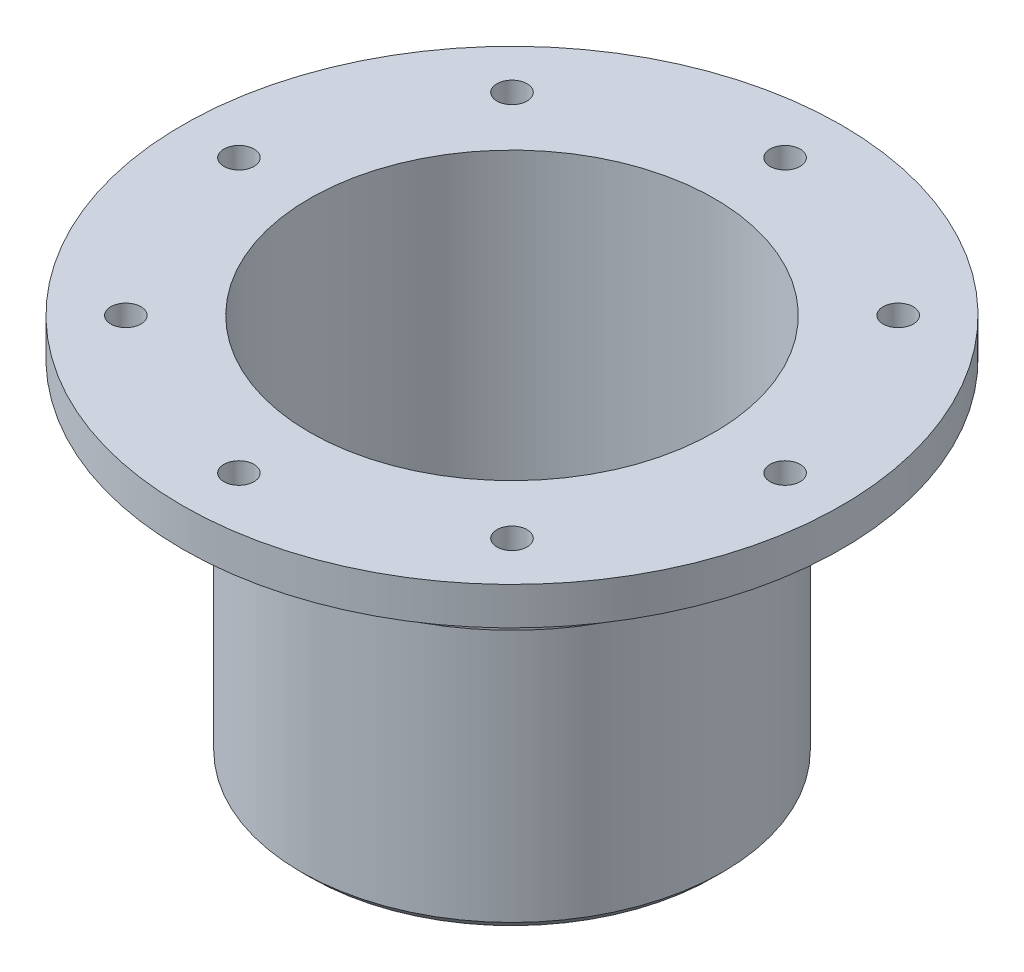
from build123d import *

# Parameters (mm, degrees)
SKETCH_1_R      = 22.4
SKETCH_1_R_2    = 2
SKETCH_1_R_3    = 14
EXTRUDE_1_DEPTH = 3
EXTRUDE_START   = 34
SKETCH_1_3_R    = 22.4
SKETCH_1_3_R_2  = 21.5
EXTRUDE_2_DEPTH = 34
EXTRUDE_START_2 = 4
SKETCH_2_R      = 35
SKETCH_2_R_2    = 21.5
SKETCH_2_R_3    = 1.6
EXTRUDE_3_DEPTH = 4
SKETCH_3_R      = 24
SKETCH_3_R_2    = 22.4
EXTRUDE_4_DEPTH = 8
CHAMFER_1_SIZE  = 1


with BuildPart() as part:
    # 草图1 → 凸台-拉伸1 (new body)
    with BuildSketch(Plane(origin=(0, 0, 0), x_dir=(1, 0, 0), z_dir=(0, 1, 0))):
        Circle(SKETCH_1_R)
        with Locations((0, -17.5)):
            Circle(SKETCH_1_R_2, mode=Mode.SUBTRACT)
        with Locations((-17.5, 0)):
            Circle(SKETCH_1_R_2, mode=Mode.SUBTRACT)
        Circle(SKETCH_1_R_3, mode=Mode.SUBTRACT)
        with Locations((17.5, 0)):
            Circle(SKETCH_1_R_2, mode=Mode.SUBTRACT)
        with Locations((0, 17.5)):
            Circle(SKETCH_1_R_2, mode=Mode.SUBTRACT)
    extrude(amount=-EXTRUDE_1_DEPTH)

    # 草图1<3> → 凸台-拉伸2 (add)
    with BuildSketch(Plane(origin=(0, 0, 0), x_dir=(1, 0, 0), z_dir=(0, 1, 0)).offset(EXTRUDE_START)):
        Circle(SKETCH_1_3_R)
        Circle(SKETCH_1_3_R_2, mode=Mode.SUBTRACT)
    extrude(amount=-EXTRUDE_2_DEPTH)

    # 草图2 → 凸台-拉伸3 (add)
    with BuildSketch(Plane(origin=(0, 34, 0), x_dir=(1, 0, 0), z_dir=(0, 1, 0)).offset(EXTRUDE_START_2)):
        Circle(SKETCH_2_R)
        Circle(SKETCH_2_R_2, mode=Mode.SUBTRACT)
        with Locations((29, 0)):
            Circle(SKETCH_2_R_3, mode=Mode.SUBTRACT)
        with Locations((20.506096654, -20.506096654)):
            Circle(SKETCH_2_R_3, mode=Mode.SUBTRACT)
        with Locations((0, -29)):
            Circle(SKETCH_2_R_3, mode=Mode.SUBTRACT)
        with Locations((-20.506096654, -20.506096654)):
            Circle(SKETCH_2_R_3, mode=Mode.SUBTRACT)
        with Locations((-29, 0)):
            Circle(SKETCH_2_R_3, mode=Mode.SUBTRACT)
        with Locations((-20.506096654, 20.506096654)):
            Circle(SKETCH_2_R_3, mode=Mode.SUBTRACT)
        with Locations((0, 29)):
            Circle(SKETCH_2_R_3, mode=Mode.SUBTRACT)
        with Locations((20.506096654, 20.506096654)):
            Circle(SKETCH_2_R_3, mode=Mode.SUBTRACT)
    extrude(amount=-EXTRUDE_3_DEPTH)

    # 草图3 → 凸台-拉伸4 (add)
    with BuildSketch(Plane.XZ.offset(-34)):
        Circle(SKETCH_3_R)
        Circle(SKETCH_3_R_2, mode=Mode.SUBTRACT)
    extrude(amount=EXTRUDE_4_DEPTH)

    # 倒角1
    chamfer_1_edges = [part.edges().sort_by_distance(p)[0] for p in [
        (-22.4, -3, 0),
    ]]
    chamfer(chamfer_1_edges, length=CHAMFER_1_SIZE)


solid = part.part
